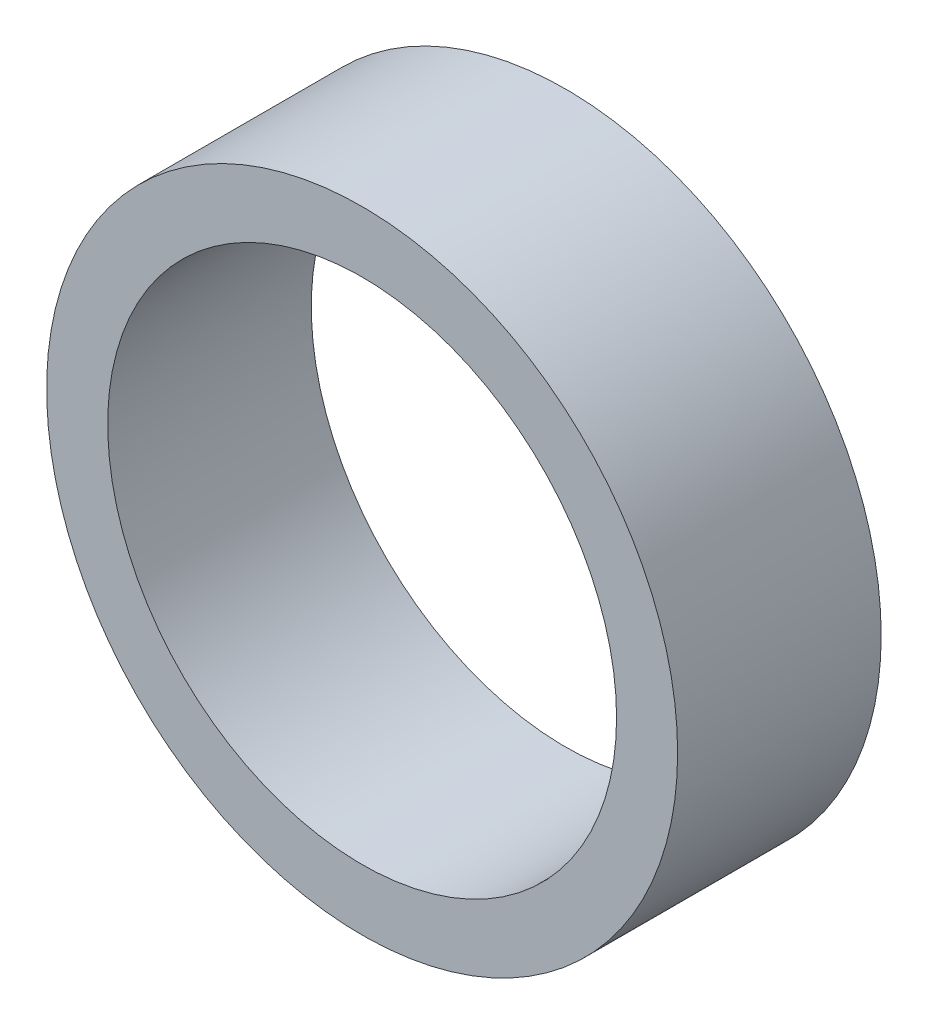
from build123d import *

# Parameters (mm, degrees)
SZKIC1_R                    = 15.5
SZKIC1_R_2                  = 12.5
DODANIE_WYCI_GNI_CIE1_DEPTH = 10


with BuildPart() as part:
    # Szkic1 → Dodanie-wyciągnięcie1 (new body)
    with BuildSketch(Plane.XY):
        Circle(SZKIC1_R)
        Circle(SZKIC1_R_2, mode=Mode.SUBTRACT)
    extrude(amount=DODANIE_WYCI_GNI_CIE1_DEPTH)


solid = part.part
